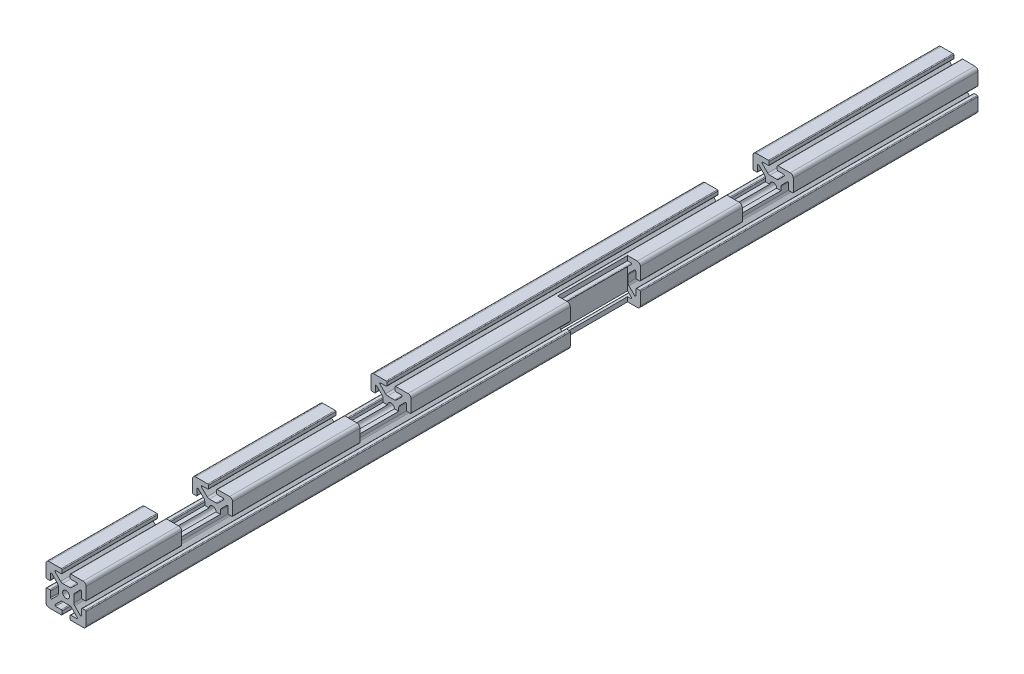
from build123d import *

# Parameters (mm, degrees)
SKETCH1_R          = 3.4036
EXTRUDE1_DEPTH     = 444.5
CUT_EXTRUDE2_REACH = 447.399
SKETCH3_W          = 109.66039792
SKETCH3_H          = 50.8
SKETCH4_W          = 69.85
SKETCH4_H          = 74.708477944
CUT_EXTRUDE3_DEPTH = 12.7


with BuildPart() as part:
    # Sketch1 → Extrude1 (new, symmetric)
    with BuildSketch(Plane.XY):
        with BuildLine():
            Line((-20, 16.952), (-20, 4.7625))
            ThreePointArc((-20, 4.7625), (-19.776815367, 4.223684633), (-19.238, 4.0005))
            Line((-19.238, 4.0005), (-16.2662, 4.0005))
            ThreePointArc((-16.2662, 4.0005), (-15.727384633, 4.223684633), (-15.5042, 4.7625))
            Line((-15.5042, 4.7625), (-15.5042, 10.485558599))
            ThreePointArc((-15.5042, 10.485558599), (-15.033804775, 11.189554802), (-14.203384633, 11.024373966))
            Line((-14.203384633, 11.024373966), (-8.635059555, 5.456048889))
            ThreePointArc((-8.635059555, 5.456048889), (-7.985348265, 4.483687227), (-7.7572, 3.336708444))
            Line((-7.7572, 3.336708444), (-7.7572, -3.336708444))
            ThreePointArc((-7.7572, -3.336708444), (-7.985348265, -4.483687227), (-8.635059555, -5.456048889))
            Line((-8.635059555, -5.456048889), (-14.203384633, -11.024373966))
            ThreePointArc((-14.203384633, -11.024373966), (-15.033804775, -11.189554802), (-15.5042, -10.485558599))
            Line((-15.5042, -10.485558599), (-15.5042, -4.7625))
            ThreePointArc((-15.5042, -4.7625), (-15.727384633, -4.223684633), (-16.2662, -4.0005))
            Line((-16.2662, -4.0005), (-19.238, -4.0005))
            ThreePointArc((-19.238, -4.0005), (-19.776815367, -4.223684633), (-20, -4.7625))
            Line((-20, -4.7625), (-20, -16.952))
            ThreePointArc((-20, -16.952), (-19.107261469, -19.107261469), (-16.952, -20))
            Line((-16.952, -20), (-4.7625, -20))
            ThreePointArc((-4.7625, -20), (-4.223684633, -19.776815367), (-4.0005, -19.238))
            Line((-4.0005, -19.238), (-4.0005, -16.2662))
            ThreePointArc((-4.0005, -16.2662), (-4.223684633, -15.727384633), (-4.7625, -15.5042))
            Line((-4.7625, -15.5042), (-10.485558599, -15.5042))
            ThreePointArc((-10.485558599, -15.5042), (-11.189554802, -15.033804775), (-11.024373966, -14.203384633))
            Line((-11.024373966, -14.203384633), (-5.456048889, -8.635059555))
            ThreePointArc((-5.456048889, -8.635059555), (-4.483687227, -7.985348265), (-3.336708444, -7.7572))
            Line((-3.336708444, -7.7572), (3.336708444, -7.7572))
            ThreePointArc((3.336708444, -7.7572), (4.483687227, -7.985348265), (5.456048889, -8.635059555))
            Line((5.456048889, -8.635059555), (11.024373966, -14.203384633))
            ThreePointArc((11.024373966, -14.203384633), (11.189554802, -15.033804775), (10.485558599, -15.5042))
            Line((10.485558599, -15.5042), (4.7625, -15.5042))
            ThreePointArc((4.7625, -15.5042), (4.223684633, -15.727384633), (4.0005, -16.2662))
            Line((4.0005, -16.2662), (4.0005, -19.238))
            ThreePointArc((4.0005, -19.238), (4.223684633, -19.776815367), (4.7625, -20))
            Line((4.7625, -20), (16.952, -20))
            ThreePointArc((16.952, -20), (19.107261469, -19.107261469), (20, -16.952))
            Line((20, -16.952), (20, -4.7625))
            ThreePointArc((20, -4.7625), (19.776815367, -4.223684633), (19.238, -4.0005))
            Line((19.238, -4.0005), (16.2662, -4.0005))
            ThreePointArc((16.2662, -4.0005), (15.727384633, -4.223684633), (15.5042, -4.7625))
            Line((15.5042, -4.7625), (15.5042, -10.485558599))
            ThreePointArc((15.5042, -10.485558599), (15.033804775, -11.189554802), (14.203384633, -11.024373966))
            Line((14.203384633, -11.024373966), (8.635059555, -5.456048889))
            ThreePointArc((8.635059555, -5.456048889), (7.985348265, -4.483687227), (7.7572, -3.336708444))
            Line((7.7572, -3.336708444), (7.7572, 3.336708444))
            ThreePointArc((7.7572, 3.336708444), (7.985348265, 4.483687227), (8.635059555, 5.456048889))
            Line((8.635059555, 5.456048889), (14.203384633, 11.024373966))
            ThreePointArc((14.203384633, 11.024373966), (15.033804775, 11.189554802), (15.5042, 10.485558599))
            Line((15.5042, 10.485558599), (15.5042, 4.7625))
            ThreePointArc((15.5042, 4.7625), (15.727384633, 4.223684633), (16.2662, 4.0005))
            Line((16.2662, 4.0005), (19.238, 4.0005))
            ThreePointArc((19.238, 4.0005), (19.776815367, 4.223684633), (20, 4.7625))
            Line((20, 4.7625), (20, 16.952))
            ThreePointArc((20, 16.952), (19.107261469, 19.107261469), (16.952, 20))
            Line((16.952, 20), (4.7625, 20))
            ThreePointArc((4.7625, 20), (4.223684633, 19.776815367), (4.0005, 19.238))
            Line((4.0005, 19.238), (4.0005, 16.2662))
            ThreePointArc((4.0005, 16.2662), (4.223684633, 15.727384633), (4.7625, 15.5042))
            Line((4.7625, 15.5042), (10.485558599, 15.5042))
            ThreePointArc((10.485558599, 15.5042), (11.189554802, 15.033804775), (11.024373966, 14.203384633))
            Line((11.024373966, 14.203384633), (5.456048889, 8.635059555))
            ThreePointArc((5.456048889, 8.635059555), (4.483687227, 7.985348265), (3.336708444, 7.7572))
            Line((3.336708444, 7.7572), (-3.336708444, 7.7572))
            ThreePointArc((-3.336708444, 7.7572), (-4.483687227, 7.985348265), (-5.456048889, 8.635059555))
            Line((-5.456048889, 8.635059555), (-11.024373966, 14.203384633))
            ThreePointArc((-11.024373966, 14.203384633), (-11.189554802, 15.033804775), (-10.485558599, 15.5042))
            Line((-10.485558599, 15.5042), (-4.7625, 15.5042))
            ThreePointArc((-4.7625, 15.5042), (-4.223684633, 15.727384633), (-4.0005, 16.2662))
            Line((-4.0005, 16.2662), (-4.0005, 19.238))
            ThreePointArc((-4.0005, 19.238), (-4.223684633, 19.776815367), (-4.7625, 20))
            Line((-4.7625, 20), (-16.952, 20))
            ThreePointArc((-16.952, 20), (-19.107261469, 19.107261469), (-20, 16.952))
        make_face()
        Circle(SKETCH1_R, mode=Mode.SUBTRACT)
    extrude(amount=EXTRUDE1_DEPTH, both=True)

    # Cut-Extrude2: up to this face of the body (flat: up to its plane)
    cut_extrude2_end = Plane(part.part.faces().sort_by_distance((-10.85725, 20, 0))[0])
    # Sketch3 → Cut-Extrude2 (cut, up to the picked face)
    with BuildSketch(Plane(origin=(0, 0, 0), x_dir=(-1, 0, 0), z_dir=(0, -1, 0)), mode=Mode.PRIVATE) as cut_extrude2_sk1:
        with Locations((7.408430589, 234.95)):
            Rectangle(SKETCH3_W, SKETCH3_H)
    cut_extrude2_tool1 = split(extrude(cut_extrude2_sk1.sketch, amount=-CUT_EXTRUDE2_REACH, mode=Mode.PRIVATE), bisect_by=cut_extrude2_end, keep=Keep.BOTH, mode=Mode.PRIVATE)
    # Sketch3 → Cut-Extrude2 (cut, up to the picked face)
    with BuildSketch(Plane(origin=(0, 0, 0), x_dir=(-1, 0, 0), z_dir=(0, -1, 0)), mode=Mode.PRIVATE) as cut_extrude2_sk2:
        with Locations((7.408430589, -146.05)):
            Rectangle(SKETCH3_W, SKETCH3_H)
    cut_extrude2_tool2 = split(extrude(cut_extrude2_sk2.sketch, amount=-CUT_EXTRUDE2_REACH, mode=Mode.PRIVATE), bisect_by=cut_extrude2_end, keep=Keep.BOTH, mode=Mode.PRIVATE)
    # Sketch3 → Cut-Extrude2 (cut, up to the picked face)
    with BuildSketch(Plane(origin=(0, 0, 0), x_dir=(-1, 0, 0), z_dir=(0, -1, 0)), mode=Mode.PRIVATE) as cut_extrude2_sk3:
        with Locations((7.408430589, -323.85)):
            Rectangle(SKETCH3_W, SKETCH3_H)
    cut_extrude2_tool3 = split(extrude(cut_extrude2_sk3.sketch, amount=-CUT_EXTRUDE2_REACH, mode=Mode.PRIVATE), bisect_by=cut_extrude2_end, keep=Keep.BOTH, mode=Mode.PRIVATE)
    add(cut_extrude2_tool1.solids().sort_by(Axis((-7.408431, 0, -234.95), (0, 1, 0)))[0], mode=Mode.SUBTRACT)
    add(cut_extrude2_tool2.solids().sort_by(Axis((-7.408431, 0, 146.05), (0, 1, 0)))[0], mode=Mode.SUBTRACT)
    add(cut_extrude2_tool3.solids().sort_by(Axis((-7.408431, 0, 323.85), (0, 1, 0)))[0], mode=Mode.SUBTRACT)

    # Sketch4 → Cut-Extrude3 (cut)
    with BuildSketch(Plane(origin=(20, 0, 0), x_dir=(0, 0, -1), z_dir=(1, 0, 0))):
        with Locations((73.025, 0)):
            Rectangle(SKETCH4_W, SKETCH4_H)
    extrude(amount=-CUT_EXTRUDE3_DEPTH, mode=Mode.SUBTRACT)


solid = part.part
